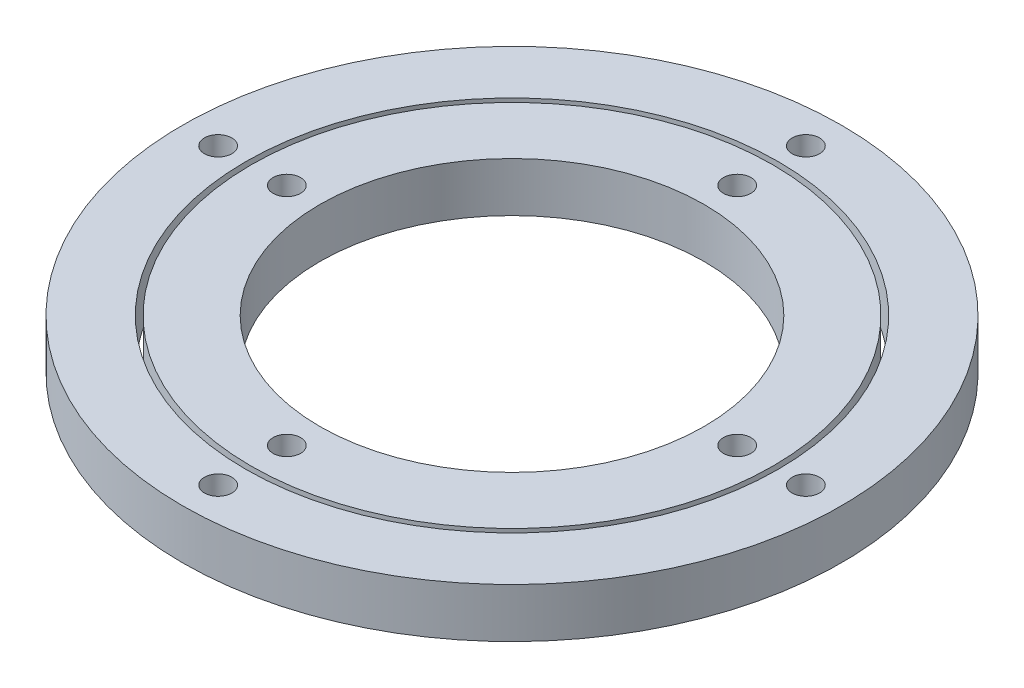
from build123d import *

# Parameters (mm, degrees)
SKETCH_1_R      = 47.5
SKETCH_1_R_2    = 35
SKETCH_1_R_3    = 2.5
EXTRUDE_1_DEPTH = 9
SKETCH_2_R      = 60
SKETCH_2_R_2    = 48.5
SKETCH_2_R_3    = 2.5
EXTRUDE_2_DEPTH = 9


with BuildPart() as part:
    # 草图1 → 凸台-拉伸1 (new body)
    with BuildSketch(Plane(origin=(0, 0, 0), x_dir=(1, 0, 0), z_dir=(0, 1, 0))):
        with Locations(Location((0, 0, 0), (0, 0, 270))):
            Circle(SKETCH_1_R)
        with Locations(Location((0, 0, 0), (0, 0, 270))):
            Circle(SKETCH_1_R_2, mode=Mode.SUBTRACT)
        with Locations(Location((-41, 0, 0), (0, 0, 270))):
            Circle(SKETCH_1_R_3, mode=Mode.SUBTRACT)
        with Locations(Location((41, 0, 0), (0, 0, 90))):
            Circle(SKETCH_1_R_3, mode=Mode.SUBTRACT)
        with Locations(Location((0, -41, 0), (0, 0, 270))):
            Circle(SKETCH_1_R_3, mode=Mode.SUBTRACT)
        with Locations(Location((0, 41, 0), (0, 0, 90))):
            Circle(SKETCH_1_R_3, mode=Mode.SUBTRACT)
    extrude(amount=EXTRUDE_1_DEPTH)


with BuildPart() as body_2:
    # 草图2 → 凸台-拉伸2 (new body)
    with BuildSketch(Plane.XZ):
        with Locations(Location((0, 0, 0), (0, 0, 270))):
            Circle(SKETCH_2_R)
        with Locations(Location((0, 0, 0), (0, 0, 270))):
            Circle(SKETCH_2_R_2, mode=Mode.SUBTRACT)
        with Locations(Location((0, 53.5, 0), (0, 0, 270))):
            Circle(SKETCH_2_R_3, mode=Mode.SUBTRACT)
        with Locations(Location((-53.5, 0, 0), (0, 0, 90))):
            Circle(SKETCH_2_R_3, mode=Mode.SUBTRACT)
        with Locations(Location((0, -53.5, 0), (0, 0, 90))):
            Circle(SKETCH_2_R_3, mode=Mode.SUBTRACT)
        with Locations(Location((53.5, 0, 0), (0, 0, 270))):
            Circle(SKETCH_2_R_3, mode=Mode.SUBTRACT)
    extrude(amount=-EXTRUDE_2_DEPTH)


solid = Compound([part.part, body_2.part])
